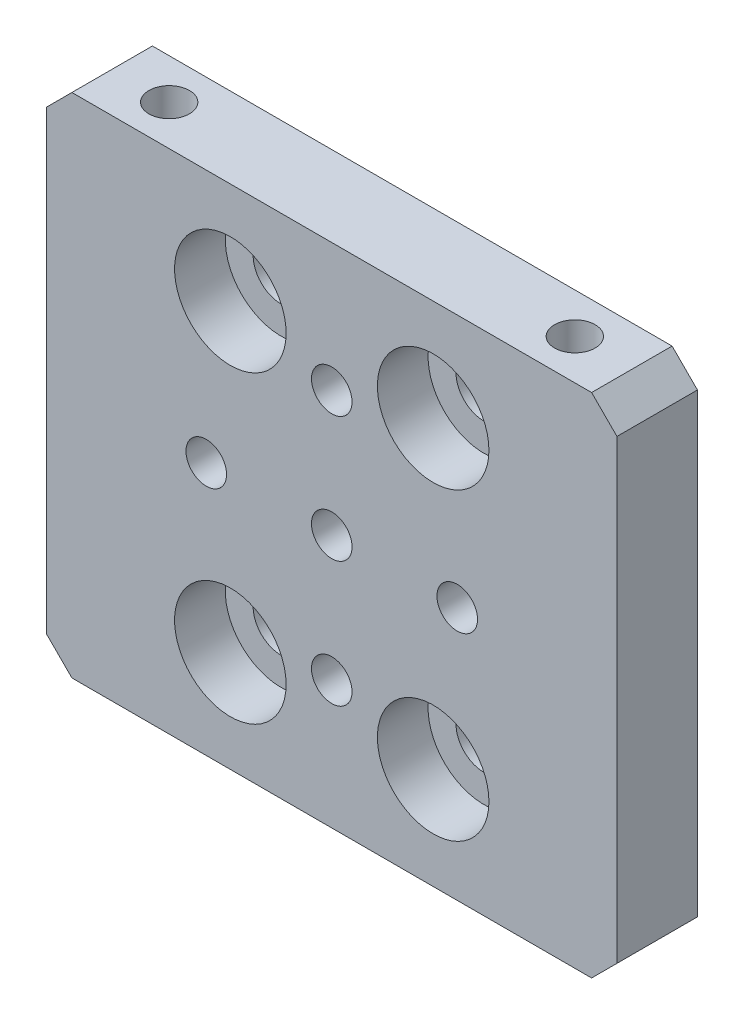
from build123d import *

# Parameters (mm, degrees)
SKETCH1_W                      = 22.5
SKETCH1_H                      = 20
BOSS_EXTRUDE1_DEPTH            = 3.175
CBORE_FOR_M2_SHCS1_D           = 2.2
CBORE_FOR_M2_SHCS1_CBORE_D     = 4.4
CBORE_FOR_M2_SHCS1_CBORE_DEPTH = 2
TAP_DRILL_FOR_M2X0_4_TAP1_D    = 1.6
TAP_DRILL_FOR_M2X0_4_TAP2_D    = 1.6
FILLET1_SIZE                   = 1


with BuildPart() as part:
    # Sketch1 → Boss-Extrude1 (new body)
    with BuildSketch(Plane.XY):
        Rectangle(SKETCH1_W, SKETCH1_H)
    extrude(amount=BOSS_EXTRUDE1_DEPTH)

    # CBORE for M2 SHCS1 (through all)
    with Locations(Plane.XY.offset(3.175)):
        with Locations((4, 6), (-4, -6), (-4, 6), (4, -6)):
            CounterBoreHole(CBORE_FOR_M2_SHCS1_D / 2, CBORE_FOR_M2_SHCS1_CBORE_D / 2, CBORE_FOR_M2_SHCS1_CBORE_DEPTH)

    # Tap Drill for M2x0.4 Tap1 (through all)
    with Locations(Plane(origin=(0, 10, 0), x_dir=(1, 0, 0), z_dir=(0, 1, 0))):
        with Locations((8, -1.5875), (-8, -1.5875)):
            Hole(TAP_DRILL_FOR_M2X0_4_TAP1_D / 2)

    # Tap Drill for M2x0.4 Tap2 (through all)
    with Locations(Plane.XY.offset(3.175)):
        with Locations((0, 0), (-4.949747468, 0), (0, -4.949747468), (4.949747468, 0), (0, 4.949747468)):
            Hole(TAP_DRILL_FOR_M2X0_4_TAP2_D / 2)

    # Fillet1
    fillet1_edges = [part.edges().sort_by_distance(p)[0] for p in [
        (11.25, -10, 1.5875),
        (-11.25, -10, 1.5875),
        (-11.25, 10, 1.5875),
        (11.25, 10, 1.5875),
    ]]
    chamfer(fillet1_edges, length=FILLET1_SIZE)


solid = part.part
